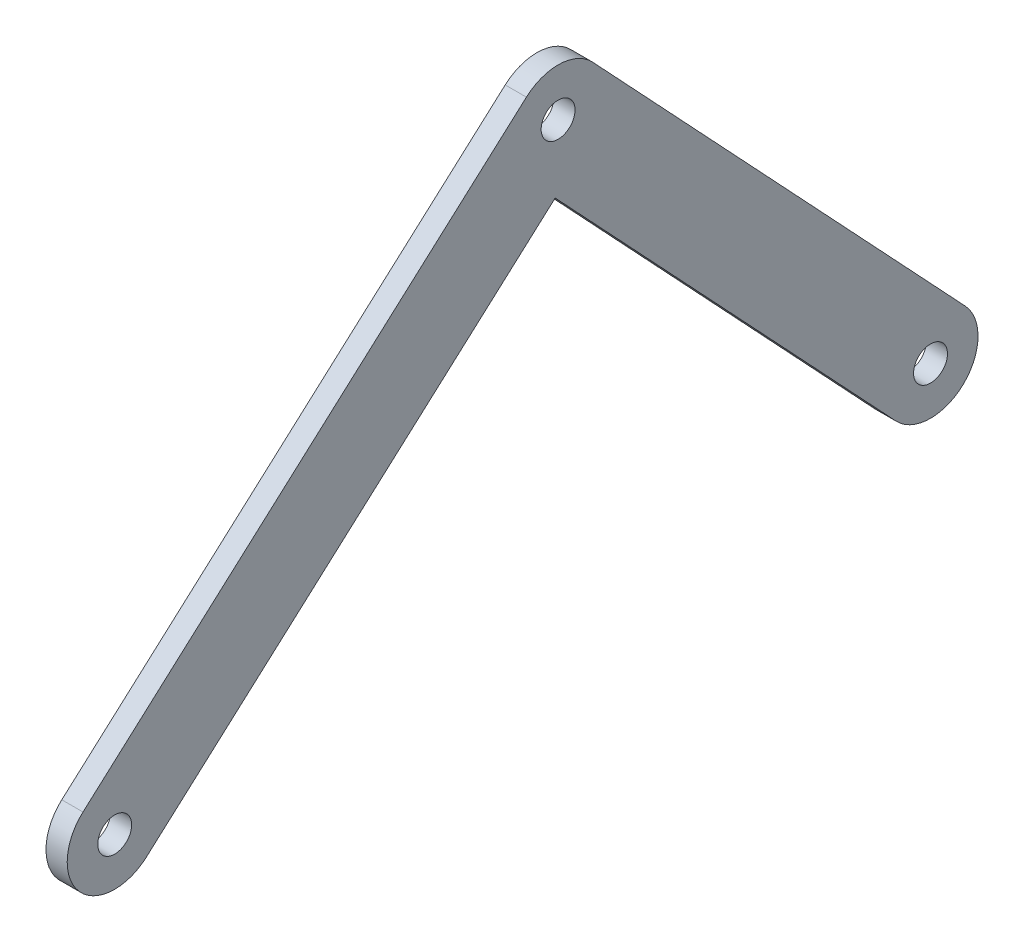
from build123d import *

# Parameters (mm, degrees)
BOSS_EXTRUDE1_DEPTH = 3.175
SKETCH3_R           = 2.54
CUT_EXTRUDE1_DEPTH  = 100.267219786


with BuildPart() as part:
    # Sketch2 → Boss-Extrude1 (new body)
    with BuildSketch(Plane(origin=(0, 0, 0), x_dir=(0, 0, -1), z_dir=(1, 0, 0))):
        with BuildLine():
            Line((60.967707714, -54.648816697), (5.189086512, 4.863530115))
            ThreePointArc((5.189086512, 4.863530115), (7.105260379, -0.309546352), (4.746461891, -5.296380228))
            Line((4.746461891, -5.296380228), (-0.432958039, -9.938025702))
            Line((-0.432958039, -9.938025702), (50.589534691, -64.375876927))
            ThreePointArc((50.589534691, -64.375876927), (60.642151317, -64.701433324), (60.967707714, -54.648816697))
        make_face()
        with BuildLine():
            ThreePointArc((-5.189086512, -4.863530115), (-7.105260379, 0.309546352), (-4.746461891, 5.296380228))
            Line((-4.746461891, 5.296380228), (-71.153824721, -54.215966584))
            ThreePointArc((-71.153824721, -54.215966584), (-71.703743057, -64.258808703), (-61.660900939, -64.80872704))
            Line((-61.660900939, -64.80872704), (-0.432958039, -9.938025702))
            Line((-0.432958039, -9.938025702), (-5.189086512, -4.863530115))
        make_face()
        with BuildLine():
            ThreePointArc((4.746461891, -5.296380228), (7.105260379, -0.309546352), (5.189086512, 4.863530115))
            ThreePointArc((5.189086512, 4.863530115), (0.309546352, 7.105260379), (-4.746461891, 5.296380228))
            ThreePointArc((-4.746461891, 5.296380228), (-7.105260379, 0.309546352), (-5.189086512, -4.863530115))
            Line((-5.189086512, -4.863530115), (-0.432958039, -9.938025702))
            Line((-0.432958039, -9.938025702), (4.746461891, -5.296380228))
        make_face()
    extrude(amount=BOSS_EXTRUDE1_DEPTH)

    # Sketch3 → Cut-Extrude1 (cut, through all)
    with BuildSketch(Plane(origin=(3.175, 0, 0), x_dir=(0, 0, -1), z_dir=(1, 0, 0))):
        Circle(SKETCH3_R)
        with Locations((-66.40736283, -59.512346812)):
            Circle(SKETCH3_R)
        with Locations((55.778621202, -59.512346812)):
            Circle(SKETCH3_R)
    extrude(amount=-CUT_EXTRUDE1_DEPTH, mode=Mode.SUBTRACT)


solid = part.part
